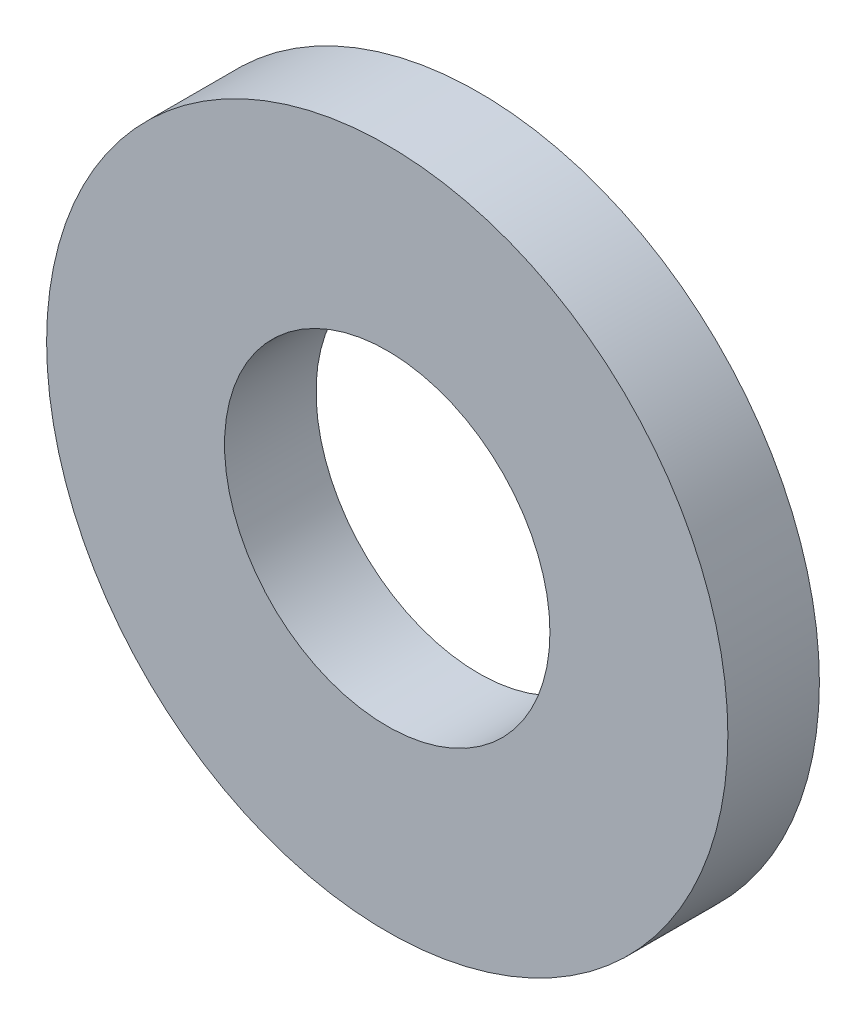
from build123d import *

# Parameters (mm, degrees)
SKETCH_1_R      = 3.35
SKETCH_1_R_2    = 1.6
EXTRUDE_1_DEPTH = 0.9


with BuildPart() as part:
    # 草图1 → 凸台-拉伸1 (new body)
    with BuildSketch(Plane.XY):
        Circle(SKETCH_1_R)
        Circle(SKETCH_1_R_2, mode=Mode.SUBTRACT)
    extrude(amount=EXTRUDE_1_DEPTH)


solid = part.part
